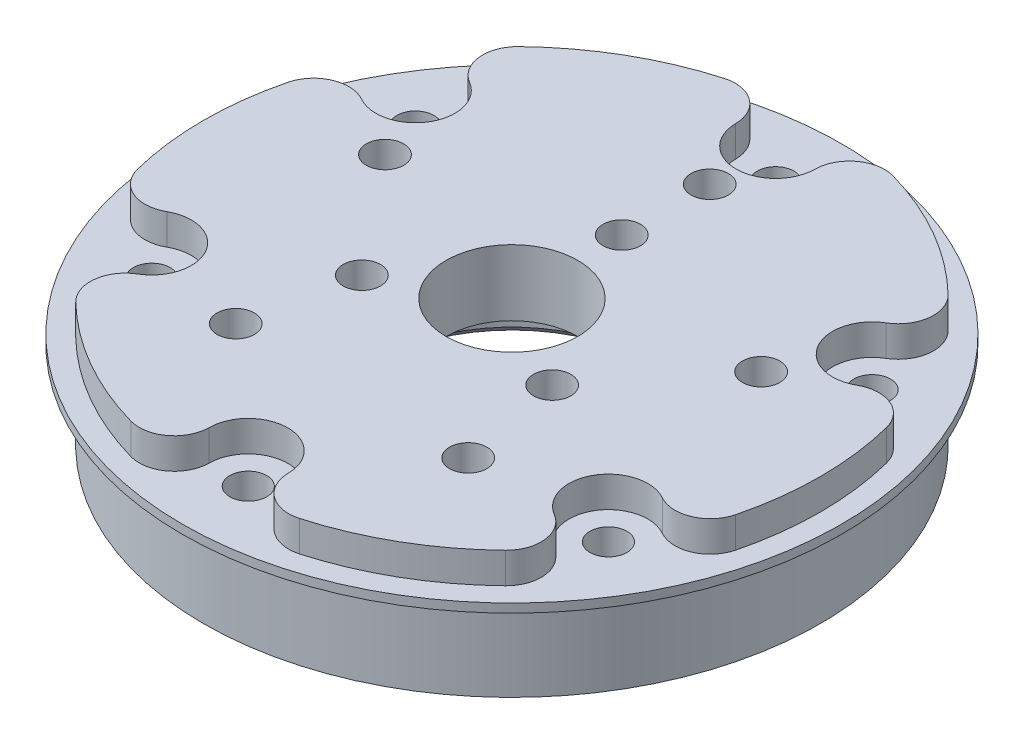
from build123d import *

# Parameters (mm, degrees)
SKETCH1_R           = 35.1
SKETCH1_R_2         = 2.1
BOSS_EXTRUDE1_DEPTH = 14.5
BOSS_EXTRUDE2_START = 10
SKETCH1_3_R         = 37.5
SKETCH1_3_R_2       = 2.1
BOSS_EXTRUDE2_DEPTH = 1
SKETCH2_R           = 2.125
SKETCH2_R_2         = 7.5
CUT_EXTRUDE1_DEPTH  = 55.97954165
CUT_EXTRUDE2_START  = -3.5
CUT_EXTRUDE2_DEPTH  = 3.5
FILLET1_R           = 4
SKETCH4_R           = 15.1
CUT_EXTRUDE3_DEPTH  = 7
CUT_EXTRUDE4_DEPTH  = 3.2
CHAMFER1_SIZE       = 1


with BuildPart() as part:
    # Sketch1 → Boss-Extrude1 (new body)
    with BuildSketch(Plane(origin=(0, 0, 0), x_dir=(1, 0, 0), z_dir=(0, 1, 0))):
        Circle(SKETCH1_R)
        with Locations((-25.980762114, -15)):
            Circle(SKETCH1_R_2, mode=Mode.SUBTRACT)
        with Locations((0, -30)):
            Circle(SKETCH1_R_2, mode=Mode.SUBTRACT)
        with Locations((25.980762114, -15)):
            Circle(SKETCH1_R_2, mode=Mode.SUBTRACT)
        with Locations((-25.980762114, 15)):
            Circle(SKETCH1_R_2, mode=Mode.SUBTRACT)
        with Locations((25.980762114, 15)):
            Circle(SKETCH1_R_2, mode=Mode.SUBTRACT)
        with Locations((0, 30)):
            Circle(SKETCH1_R_2, mode=Mode.SUBTRACT)
    extrude(amount=BOSS_EXTRUDE1_DEPTH)

    # Sketch1<3> → Boss-Extrude2 (add)
    with BuildSketch(Plane(origin=(0, 0, 0), x_dir=(1, 0, 0), z_dir=(0, 1, 0)).offset(BOSS_EXTRUDE2_START)):
        Circle(SKETCH1_3_R)
        with Locations((-25.980762114, -15)):
            Circle(SKETCH1_3_R_2, mode=Mode.SUBTRACT)
        with Locations((0, -30)):
            Circle(SKETCH1_3_R_2, mode=Mode.SUBTRACT)
        with Locations((25.980762114, -15)):
            Circle(SKETCH1_3_R_2, mode=Mode.SUBTRACT)
        with Locations((-25.980762114, 15)):
            Circle(SKETCH1_3_R_2, mode=Mode.SUBTRACT)
        with Locations((25.980762114, 15)):
            Circle(SKETCH1_3_R_2, mode=Mode.SUBTRACT)
        with Locations((0, 30)):
            Circle(SKETCH1_3_R_2, mode=Mode.SUBTRACT)
    extrude(amount=BOSS_EXTRUDE2_DEPTH)

    # Sketch2 → Cut-Extrude1 (cut, through all)
    with BuildSketch(Plane(origin=(0, 14.5, 0), x_dir=(1, 0, 0), z_dir=(0, 1, 0))):
        with Locations((0, 22.5)):
            Circle(SKETCH2_R)
        with Locations((21.398771617, 6.952882373)):
            Circle(SKETCH2_R)
        with Locations((13.225168177, -18.202882373)):
            Circle(SKETCH2_R)
        with Locations((-13.225168177, -18.202882373)):
            Circle(SKETCH2_R)
        with Locations((-21.398771617, 6.952882373)):
            Circle(SKETCH2_R)
        with Locations((0, 12.5)):
            Circle(SKETCH2_R)
        with Locations((10.825317547, -6.25)):
            Circle(SKETCH2_R)
        with Locations((-10.825317547, -6.25)):
            Circle(SKETCH2_R)
        Circle(SKETCH2_R_2)
    extrude(amount=-CUT_EXTRUDE1_DEPTH, mode=Mode.SUBTRACT)

    # Sketch3 → Cut-Extrude2 (cut)
    with BuildSketch(Plane(origin=(0, 14.5, 0), x_dir=(1, 0, 0), z_dir=(0, 1, 0)).offset(CUT_EXTRUDE2_START)):
        with BuildLine():
            Line((4.5, 30), (4.5, 34.81034329))
            ThreePointArc((4.5, 34.81034329), (0, 35.1), (-4.5, 34.81034329))
            Line((-4.5, 34.81034329), (-4.5, 30))
            ThreePointArc((-4.5, 30), (0, 25.5), (4.5, 30))
        make_face()
        with BuildLine():
            Line((28.230762114, 11.102885683), (32.396641604, 13.508057328))
            ThreePointArc((32.396641604, 13.508057328), (30.397491673, 17.55), (27.896641604, 21.302285962))
            Line((27.896641604, 21.302285962), (23.730762114, 18.897114317))
            ThreePointArc((23.730762114, 18.897114317), (22.083647797, 12.75), (28.230762114, 11.102885683))
        make_face()
        with BuildLine():
            Line((23.730762114, -18.897114317), (27.896641604, -21.302285962))
            ThreePointArc((27.896641604, -21.302285962), (30.397491673, -17.55), (32.396641604, -13.508057328))
            Line((32.396641604, -13.508057328), (28.230762114, -11.102885683))
            ThreePointArc((28.230762114, -11.102885683), (22.083647797, -12.75), (23.730762114, -18.897114317))
        make_face()
        with BuildLine():
            Line((-4.5, -30), (-4.5, -34.81034329))
            ThreePointArc((-4.5, -34.81034329), (0, -35.1), (4.5, -34.81034329))
            Line((4.5, -34.81034329), (4.5, -30))
            ThreePointArc((4.5, -30), (0, -25.5), (-4.5, -30))
        make_face()
        with BuildLine():
            Line((-28.230762114, -11.102885683), (-32.396641604, -13.508057328))
            ThreePointArc((-32.396641604, -13.508057328), (-30.397491673, -17.55), (-27.896641604, -21.302285962))
            Line((-27.896641604, -21.302285962), (-23.730762114, -18.897114317))
            ThreePointArc((-23.730762114, -18.897114317), (-22.083647797, -12.75), (-28.230762114, -11.102885683))
        make_face()
        with BuildLine():
            Line((-23.730762114, 18.897114317), (-27.896641604, 21.302285962))
            ThreePointArc((-27.896641604, 21.302285962), (-30.397491673, 17.55), (-32.396641604, 13.508057328))
            Line((-32.396641604, 13.508057328), (-28.230762114, 11.102885683))
            ThreePointArc((-28.230762114, 11.102885683), (-22.083647797, 12.75), (-23.730762114, 18.897114317))
        make_face()
    extrude(amount=CUT_EXTRUDE2_DEPTH, mode=Mode.SUBTRACT)

    # Fillet1
    fillet1_edges = [part.edges().sort_by_distance(p)[0] for p in [
        (-32.396641604, 12.75, 13.508057328),
        (-27.896641604, 12.75, 21.302285962),
        (-4.5, 12.75, 34.81034329),
        (4.5, 12.75, 34.81034329),
        (27.896641604, 12.75, 21.302285962),
        (32.396641604, 12.75, 13.508057328),
        (32.396641604, 12.75, -13.508057328),
        (27.896641604, 12.75, -21.302285962),
        (4.5, 12.75, -34.81034329),
        (-4.5, 12.75, -34.81034329),
        (-32.396641604, 12.75, -13.508057328),
        (-27.896641604, 12.75, -21.302285962),
    ]]
    fillet(fillet1_edges, radius=FILLET1_R)

    # Sketch4 → Cut-Extrude3 (cut)
    with BuildSketch(Plane.XZ):
        Circle(SKETCH4_R)
    extrude(amount=-CUT_EXTRUDE3_DEPTH, mode=Mode.SUBTRACT)

    # Sketch5 → Cut-Extrude4 (cut)
    with BuildSketch(Plane.XZ):
        Polygon((-11.031237154, 22.002882373), (-15.4190992, 22.002882373), (-17.613030222, 18.202882373), (-15.4190992, 14.402882373), (-11.031237154, 14.402882373), (-8.837306131, 18.202882373), align=None)
        Polygon((17.517144909, 17.290594556), (16.161220968, 21.463699348), (11.869244235, 22.375987165), (8.933191444, 19.11517019), (10.289115385, 14.942065399), (14.581092118, 14.029777582), align=None)
        Polygon((21.857428093, -11.316707252), (25.407283057, -8.737586652), (24.948626581, -4.373761774), (20.94011514, -2.589057495), (17.390260176, -5.168178095), (17.848916653, -9.532002973), align=None)
        Polygon((-4.008511441, -24.284704279), (-0.458656477, -26.863824878), (3.549854964, -25.0791206), (4.008511441, -20.715295721), (0.458656477, -18.136175122), (-3.549854964, -19.9208794), align=None)
        Polygon((-24.334824408, -3.692065399), (-25.690748349, -7.86517019), (-22.754695558, -11.125987165), (-18.462718825, -10.213699348), (-17.106794884, -6.040594556), (-20.042847676, -2.779777582), align=None)
    extrude(amount=-CUT_EXTRUDE4_DEPTH, mode=Mode.SUBTRACT)

    # Chamfer1
    chamfer1_edges = [part.edges().sort_by_distance(p)[0] for p in [
        (-15.1, 0, 0),
    ]]
    chamfer(chamfer1_edges, length=CHAMFER1_SIZE)


solid = part.part
